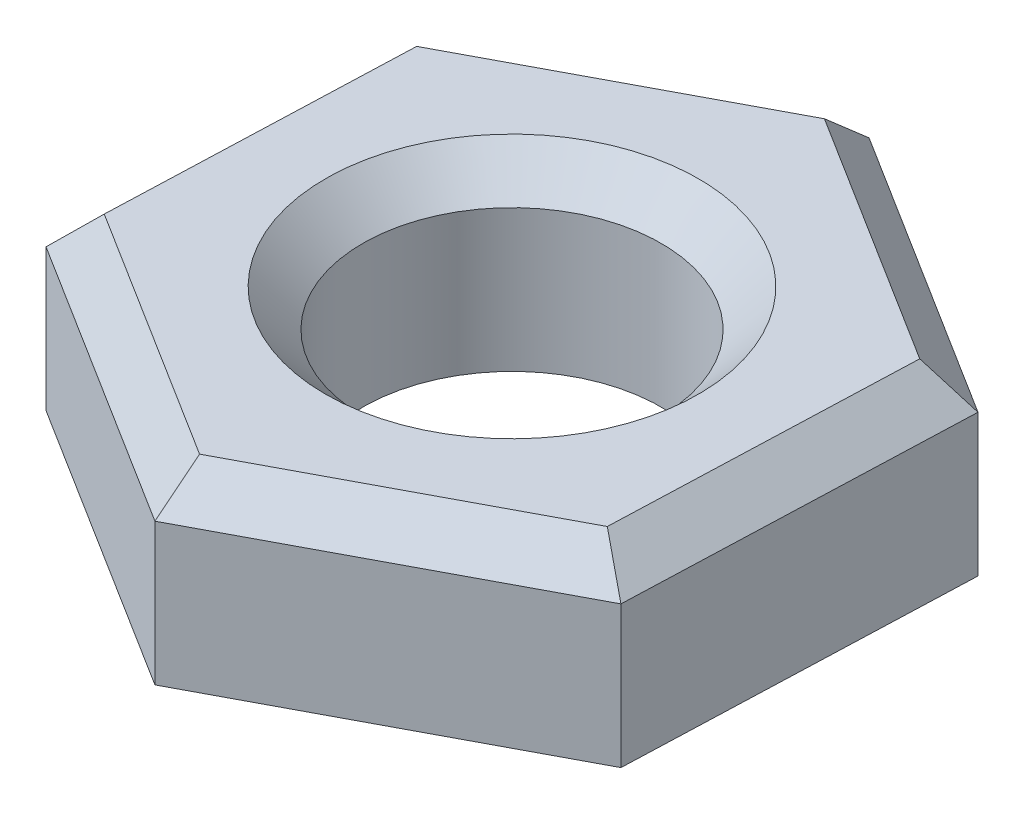
from build123d import *

# Parameters (mm, degrees)
BOSS_EXTRUDE1_DEPTH = 1.2
SKETCH2_R           = 1
CUT_EXTRUDE1_DEPTH  = 1.6
CHAMFER1_SIZE       = 0.25


with BuildPart() as part:
    # Sketch1 → Boss-Extrude1 (new body)
    with BuildSketch(Plane(origin=(0, 0, 0), x_dir=(1, 0, 0), z_dir=(0, 1, 0))):
        Polygon((-1.956558279, 1.226871238), (-2.040780799, -1.080993554), (-0.08422252, -2.307864793), (1.956558279, -1.226871238), (2.040780799, 1.080993554), (0.08422252, 2.307864793), align=None)
    extrude(amount=BOSS_EXTRUDE1_DEPTH)

    # Sketch2 → Cut-Extrude1 (cut)
    with BuildSketch(Plane(origin=(0, 1.2, 0), x_dir=(1, 0, 0), z_dir=(0, 1, 0))):
        with Locations(Location((0, 0, 0), (0, 0, 270))):
            Circle(SKETCH2_R)
    extrude(amount=-CUT_EXTRUDE1_DEPTH, mode=Mode.SUBTRACT)

    # Chamfer1
    chamfer1_edges = [part.edges().sort_by_distance(p)[0] for p in [
        (-1.062501659, 1.2, 1.694429173),
        (0.936167879, 1.2, 1.767368015),
        (1.998669539, 1.2, 0.072938842),
        (0, 1.2, -1),
        (1.062501659, 1.2, -1.694429173),
        (-0.936167879, 1.2, -1.767368015),
        (-1.998669539, 1.2, -0.072938842),
    ]]
    chamfer(chamfer1_edges, length=CHAMFER1_SIZE)


solid = part.part
